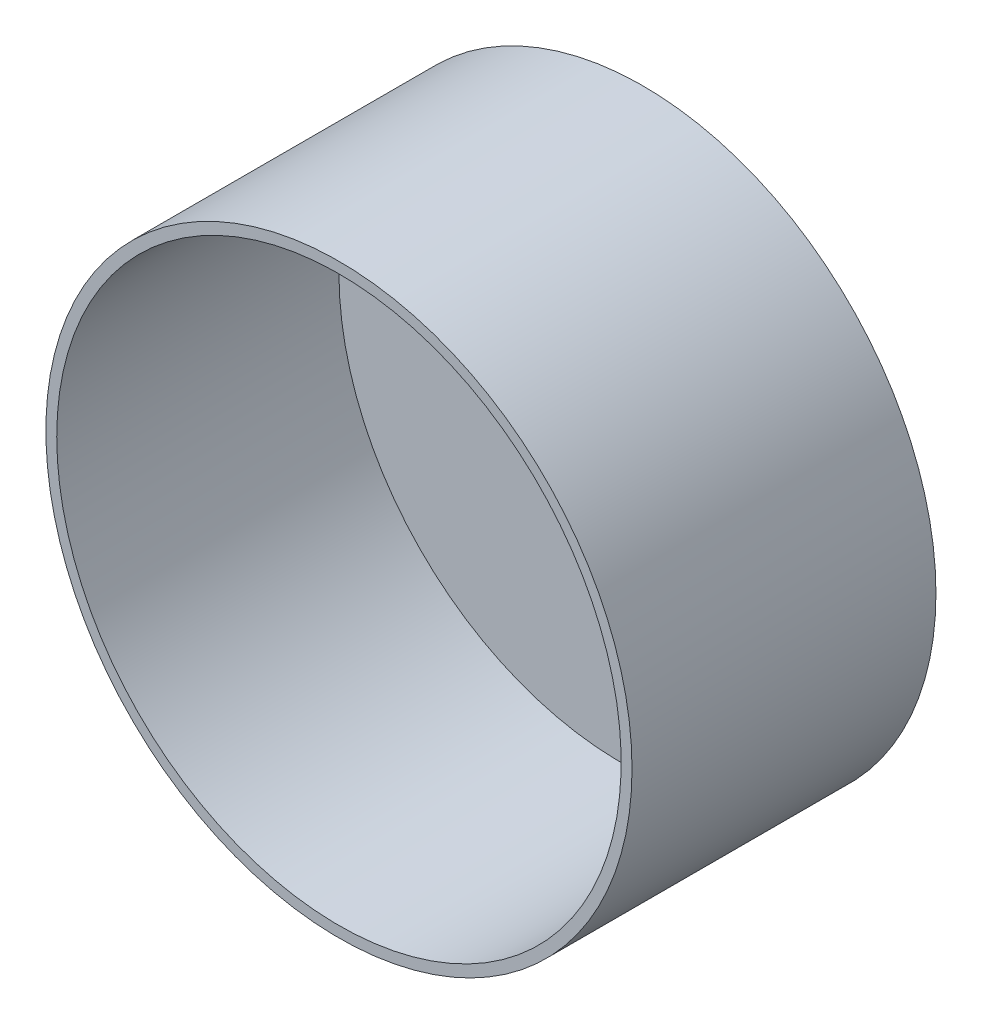
from build123d import *

# Parameters (mm, degrees)
SKETCH1_R           = 13.5
BOSS_EXTRUDE1_DEPTH = 1
SKETCH2_R           = 13.5
SKETCH2_R_2         = 13
BOSS_EXTRUDE2_DEPTH = 13


with BuildPart() as part:
    # Sketch1 → Boss-Extrude1 (new body)
    with BuildSketch(Plane.XY):
        Circle(SKETCH1_R)
    extrude(amount=BOSS_EXTRUDE1_DEPTH)

    # Sketch2 → Boss-Extrude2 (add)
    with BuildSketch(Plane.XY.offset(1)):
        Circle(SKETCH2_R)
        with Locations(Location((0, 0, 0), (0, 0, 180))):
            Circle(SKETCH2_R_2, mode=Mode.SUBTRACT)
    extrude(amount=BOSS_EXTRUDE2_DEPTH)


solid = part.part
